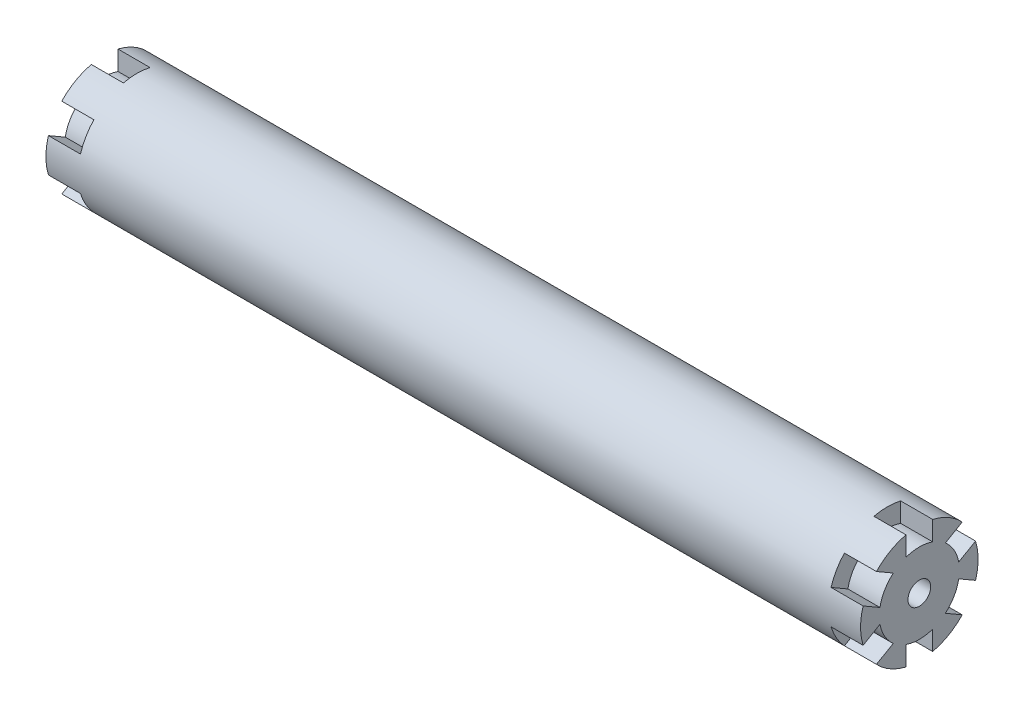
from build123d import *

# Parameters (mm, degrees)
SKETCH1_R           = 22
SKETCH1_R_2         = 4.25
BOSS_EXTRUDE1_DEPTH = 305
CUT_EXTRUDE1_DEPTH  = 12
CUT_EXTRUDE2_START  = -293
CUT_EXTRUDE2_DEPTH  = 12


with BuildPart() as part:
    # Sketch1 → Boss-Extrude1 (new body)
    with BuildSketch(Plane(origin=(0, 0, 0), x_dir=(0, 0, -1), z_dir=(1, 0, 0))):
        Circle(SKETCH1_R)
        Circle(SKETCH1_R_2, mode=Mode.SUBTRACT)
    extrude(amount=BOSS_EXTRUDE1_DEPTH)

    # Sketch2 → Cut-Extrude1 (cut)
    with BuildSketch(Plane.ZY):
        with BuildLine():
            Line((16.053975315, 15.042269662), (9.747448714, 11.401194831))
            ThreePointArc((9.747448714, 11.401194831), (12.990381057, 7.5), (14.747448714, 2.740940793))
            Line((14.747448714, 2.740940793), (21.053975315, 6.382015624))
            ThreePointArc((21.053975315, 6.382015624), (19.052558883, 11), (16.053975315, 15.042269662))
        make_face()
        with BuildLine():
            Line((21.053975315, -6.382015624), (14.747448714, -2.740940793))
            ThreePointArc((14.747448714, -2.740940793), (12.990381057, -7.5), (9.747448714, -11.401194831))
            Line((9.747448714, -11.401194831), (16.053975315, -15.042269662))
            ThreePointArc((16.053975315, -15.042269662), (19.052558883, -11), (21.053975315, -6.382015624))
        make_face()
        with BuildLine():
            ThreePointArc((5, -14.142135624), (0, -15), (-5, -14.142135624))
            Line((-5, -14.142135624), (-5, -21.424285286))
            ThreePointArc((-5, -21.424285286), (0, -22), (5, -21.424285286))
            Line((5, -21.424285286), (5, -14.142135624))
        make_face()
        with BuildLine():
            ThreePointArc((-9.747448714, -11.401194831), (-12.990381057, -7.5), (-14.747448714, -2.740940793))
            Line((-14.747448714, -2.740940793), (-21.053975315, -6.382015624))
            ThreePointArc((-21.053975315, -6.382015624), (-19.052558883, -11), (-16.053975315, -15.042269662))
            Line((-16.053975315, -15.042269662), (-9.747448714, -11.401194831))
        make_face()
        with BuildLine():
            ThreePointArc((-14.747448714, 2.740940793), (-12.990381057, 7.5), (-9.747448714, 11.401194831))
            Line((-9.747448714, 11.401194831), (-16.053975315, 15.042269662))
            ThreePointArc((-16.053975315, 15.042269662), (-19.052558883, 11), (-21.053975315, 6.382015624))
            Line((-21.053975315, 6.382015624), (-14.747448714, 2.740940793))
        make_face()
        with BuildLine():
            Line((0, 22), (0, 15))
            ThreePointArc((0, 15), (2.536529681, 14.783978395), (5, 14.142135624))
            Line((5, 14.142135624), (5, 21.424285286))
            ThreePointArc((5, 21.424285286), (2.516517804, 21.85559741), (0, 22))
        make_face()
        with BuildLine():
            ThreePointArc((-5, 14.142135624), (-2.536529681, 14.783978395), (0, 15))
            Line((0, 15), (0, 22))
            ThreePointArc((0, 22), (-2.516517804, 21.85559741), (-5, 21.424285286))
            Line((-5, 21.424285286), (-5, 14.142135624))
        make_face()
    extrude(amount=-CUT_EXTRUDE1_DEPTH, mode=Mode.SUBTRACT)

    # Sketch2<4> → Cut-Extrude2 (cut)
    with BuildSketch(Plane.ZY.offset(CUT_EXTRUDE2_START)):
        with BuildLine():
            Line((16.053975315, 15.042269662), (9.747448714, 11.401194831))
            ThreePointArc((9.747448714, 11.401194831), (12.990381057, 7.5), (14.747448714, 2.740940793))
            Line((14.747448714, 2.740940793), (21.053975315, 6.382015624))
            ThreePointArc((21.053975315, 6.382015624), (19.052558883, 11), (16.053975315, 15.042269662))
        make_face()
        with BuildLine():
            Line((0, 22), (0, 15))
            ThreePointArc((0, 15), (2.536529681, 14.783978395), (5, 14.142135624))
            Line((5, 14.142135624), (5, 21.424285286))
            ThreePointArc((5, 21.424285286), (2.516517804, 21.85559741), (0, 22))
        make_face()
        with BuildLine():
            ThreePointArc((-5, 14.142135624), (-2.536529681, 14.783978395), (0, 15))
            Line((0, 15), (0, 22))
            ThreePointArc((0, 22), (-2.516517804, 21.85559741), (-5, 21.424285286))
            Line((-5, 21.424285286), (-5, 14.142135624))
        make_face()
        with BuildLine():
            ThreePointArc((-14.747448714, 2.740940793), (-12.990381057, 7.5), (-9.747448714, 11.401194831))
            Line((-9.747448714, 11.401194831), (-16.053975315, 15.042269662))
            ThreePointArc((-16.053975315, 15.042269662), (-19.052558883, 11), (-21.053975315, 6.382015624))
            Line((-21.053975315, 6.382015624), (-14.747448714, 2.740940793))
        make_face()
        with BuildLine():
            ThreePointArc((-9.747448714, -11.401194831), (-12.990381057, -7.5), (-14.747448714, -2.740940793))
            Line((-14.747448714, -2.740940793), (-21.053975315, -6.382015624))
            ThreePointArc((-21.053975315, -6.382015624), (-19.052558883, -11), (-16.053975315, -15.042269662))
            Line((-16.053975315, -15.042269662), (-9.747448714, -11.401194831))
        make_face()
        with BuildLine():
            ThreePointArc((5, -14.142135624), (0, -15), (-5, -14.142135624))
            Line((-5, -14.142135624), (-5, -21.424285286))
            ThreePointArc((-5, -21.424285286), (0, -22), (5, -21.424285286))
            Line((5, -21.424285286), (5, -14.142135624))
        make_face()
        with BuildLine():
            Line((21.053975315, -6.382015624), (14.747448714, -2.740940793))
            ThreePointArc((14.747448714, -2.740940793), (12.990381057, -7.5), (9.747448714, -11.401194831))
            Line((9.747448714, -11.401194831), (16.053975315, -15.042269662))
            ThreePointArc((16.053975315, -15.042269662), (19.052558883, -11), (21.053975315, -6.382015624))
        make_face()
    extrude(amount=-CUT_EXTRUDE2_DEPTH, mode=Mode.SUBTRACT)


solid = part.part
